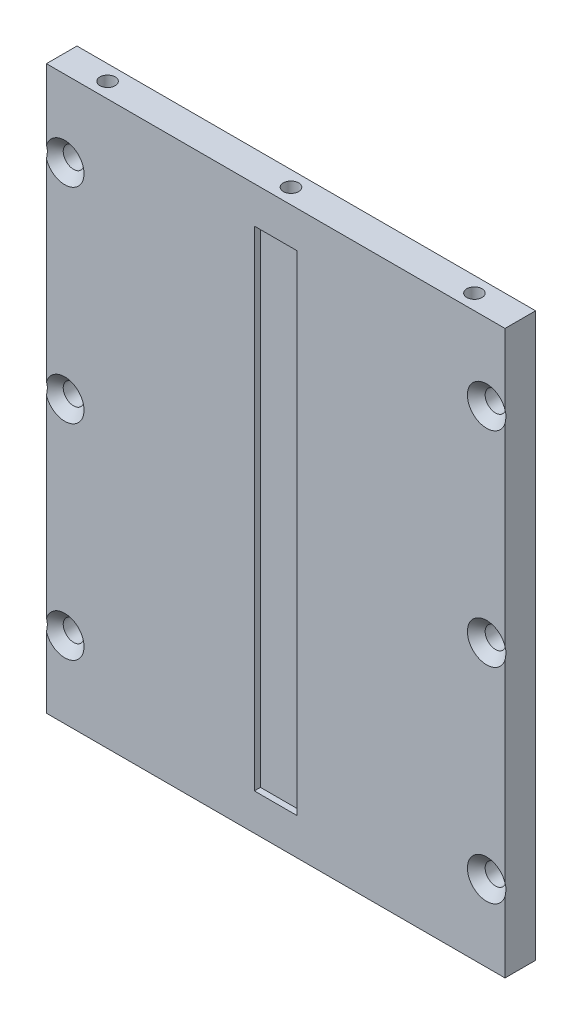
from build123d import *

# Parameters (mm, degrees)
SKETCH_1_W                   = 75
SKETCH_1_H                   = 92
EXTRUDE_460_DEPTH            = 5
HOLE_WIZARD_M3_D             = 2.5
HOLE_WIZARD_M3_2_D           = 3.4
HOLE_WIZARD_M3_2_CSINK_D     = 6.3
HOLE_WIZARD_M3_2_CSINK_ANGLE = 90
SKETCH_6_W                   = 7
SKETCH_6_H                   = 80
CUT_EXTRUDE_1_DEPTH          = 1


with BuildPart() as part:
    # Эскиз1 → Extrude 460 (new body)
    with BuildSketch(Plane.XY):
        Rectangle(SKETCH_1_W, SKETCH_1_H)
    extrude(amount=-EXTRUDE_460_DEPTH)

    # Hole Wizard M3 (through all)
    with Locations(Plane(origin=(0, 46, 0), x_dir=(1, 0, 0), z_dir=(0, 1, 0))):
        with Locations((30, 2.5), (-30, 2.5), (0, 2.5)):
            Hole(HOLE_WIZARD_M3_D / 2)

    # Hole Wizard M3 2 (through all)
    with Locations(Plane(origin=(45, 0, 0), x_dir=(-1, 0, 0), z_dir=(0, 0, 1))):
        with Locations((10.5, 0), (10.5, -33.5), (10.5, 33.5), (79.5, -33.5), (79.5, 0), (79.5, 33.5)):
            CounterSinkHole(HOLE_WIZARD_M3_2_D / 2, HOLE_WIZARD_M3_2_CSINK_D / 2, counter_sink_angle=HOLE_WIZARD_M3_2_CSINK_ANGLE)

    # Эскиз6 → Вырез-Вытянуть1 (cut)
    with BuildSketch(Plane.XY):
        Rectangle(SKETCH_6_W, SKETCH_6_H)
    extrude(amount=-CUT_EXTRUDE_1_DEPTH, mode=Mode.SUBTRACT)


solid = part.part
